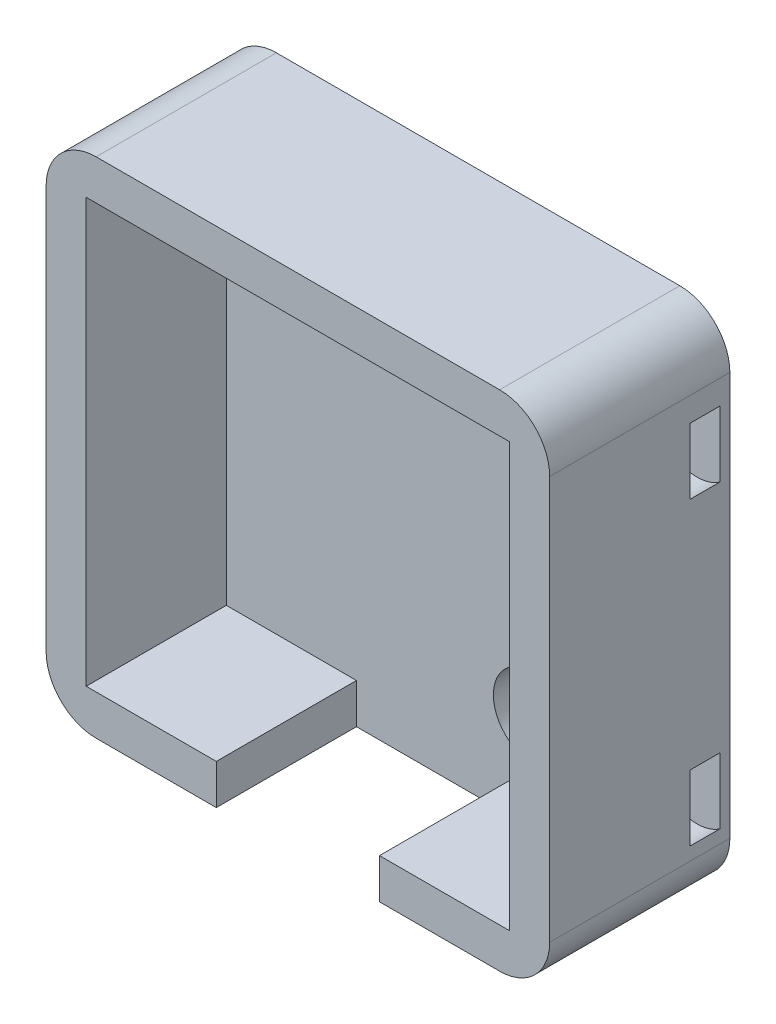
from build123d import *

# Parameters (mm, degrees)
ESQUISSE1_W             = 50.3
ESQUISSE1_H             = 50.3
BOSS_EXTRU_1_DEPTH      = 4
BOSS_EXTRU_2_DEPTH      = 14
ESQUISSE3_R             = 1.5
ENL_V_MAT_EXTRU_1_DEPTH = 74.376971864
CONG_2_R                = 5
ESQUISSE4_R             = 4
ENL_V_MAT_EXTRU_2_DEPTH = 3
CONG_6_R                = 5


with BuildPart() as part:
    # Esquisse1 → Boss.-Extru.1 (new body)
    with BuildSketch(Plane.XY):
        with Locations((25.15, 25.15)):
            Rectangle(ESQUISSE1_W, ESQUISSE1_H)
    extrude(amount=BOSS_EXTRU_1_DEPTH)

    # Esquisse2 → Boss.-Extru.2 (add)
    with BuildSketch(Plane.XY.offset(4)):
        Polygon((4, 46.3), (46.3, 46.3), (46.3, 4), (33.3, 4), (33.3, 0), (50.3, 0), (50.3, 50.3), (0, 50.3), (0, 0), (17, 0), (17, 4), (4, 4), align=None)
    extrude(amount=BOSS_EXTRU_2_DEPTH)

    # Esquisse3 → Enlèv. mat.-Extru.1 (cut, through all)
    with BuildSketch(Plane(origin=(0, 0, 0), x_dir=(-1, 0, 0), z_dir=(0, 0, -1))):
        with Locations((-34.675133859, 39.6)):
            Circle(ESQUISSE3_R)
        with Locations((-59.675133859, 39.6)):
            Circle(ESQUISSE3_R)
        with Locations((-59.675133859, 9.6)):
            Circle(ESQUISSE3_R)
        with Locations((-34.675133859, 9.6)):
            Circle(ESQUISSE3_R)
    extrude(amount=-ENL_V_MAT_EXTRU_1_DEPTH, mode=Mode.SUBTRACT)

    # Congé2
    cong_2_edges = [part.edges().sort_by_distance(p)[0] for p in [
        (0, 50.3, 9),
    ]]
    fillet(cong_2_edges, radius=CONG_2_R)

    # Esquisse4 → Enlèv. mat.-Extru.2 (cut)
    with BuildSketch(Plane.XY.offset(4)):
        with Locations((34.675133859, 39.6)):
            Circle(ESQUISSE4_R)
        with Locations((34.675133859, 9.6)):
            Circle(ESQUISSE4_R)
        with Locations((48.024217253, 39.6)):
            Circle(ESQUISSE4_R)
        with Locations((48.024217253, 9.6)):
            Circle(ESQUISSE4_R)
    extrude(amount=-ENL_V_MAT_EXTRU_2_DEPTH, mode=Mode.SUBTRACT)

    # Congé6
    cong_6_edges = [part.edges().sort_by_distance(p)[0] for p in [
        (50.3, 50.3, 9),
        (50.3, 0, 9),
        (0, 0, 9),
    ]]
    fillet(cong_6_edges, radius=CONG_6_R)


solid = part.part
